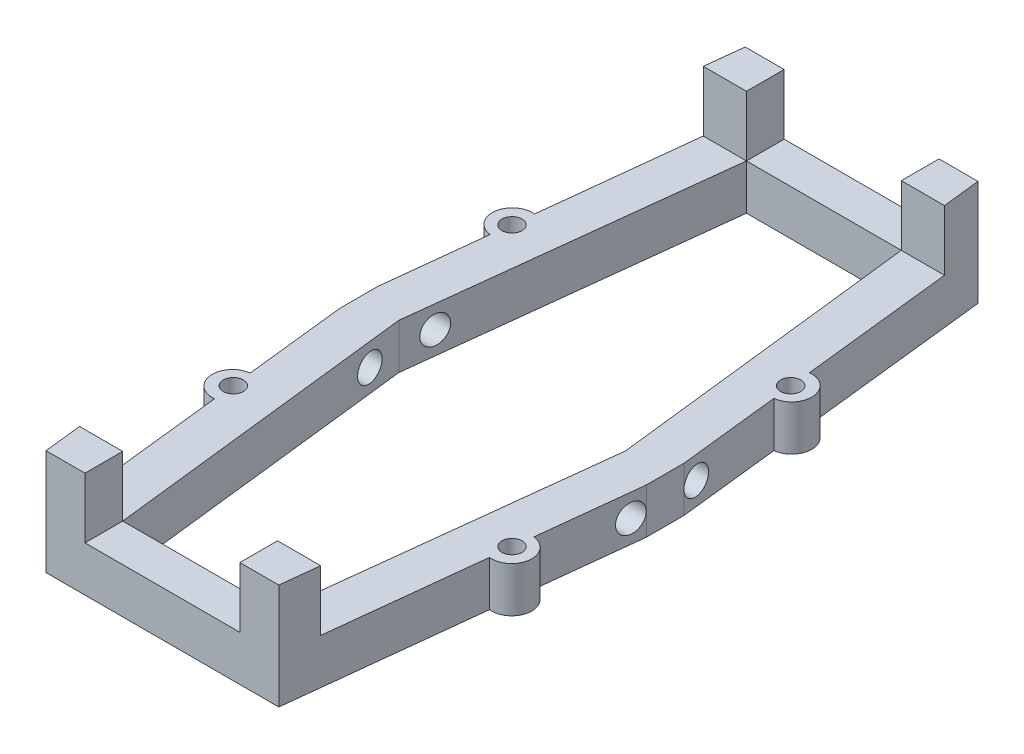
from build123d import *

# Parameters (mm, degrees)
BOSS_EXTRUDE1_DEPTH     = 4.5
BOSS_EXTRUDE5_DEPTH     = 6
SKETCH9_R               = 1
CUT_EXTRUDE2_DEPTH      = 10
CUT_EXTRUDE3_DEPTH      = 48.803846546
CUT_EXTRUDE3_DEPTH_BACK = 48.803846546
SKETCH11_R              = 1.375


with BuildPart() as part:
    # Sketch1 → Boss-Extrude1 (new body)
    with BuildSketch(Plane(origin=(0, 0, 0), x_dir=(1, 0, 0), z_dir=(0, 1, 0))):
        with BuildLine():
            Line((5.65, -1.875), (5.65, 1.875))
            Line((5.65, 1.875), (1.9, 1.875))
            Line((1.9, 1.875), (-1.875, -31))
            Line((-1.875, -31), (-17.265, -31))
            Line((-17.265, -31), (-21.04, 1.875))
            Line((-21.04, 1.875), (-24.79, 1.875))
            Line((-24.79, 1.875), (-24.79, -1.875))
            Line((-24.79, -1.875), (-23.673675208, -11.929569188))
            ThreePointArc((-23.673675208, -11.929569188), (-25.440763963, -14.138052226), (-23.232280925, -15.905140982))
            Line((-23.232280925, -15.905140982), (-21.14, -34.75))
            Line((-21.14, -34.75), (-19.14, -34.75))
            Line((-19.14, -34.75), (0, -34.75))
            Line((0, -34.75), (2, -34.75))
            Line((2, -34.75), (4.092280925, -15.905140982))
            ThreePointArc((4.092280925, -15.905140982), (6.300763963, -14.138052226), (4.533675208, -11.929569188))
            Line((4.533675208, -11.929569188), (5.65, -1.875))
        make_face()
    boss_extrude1 = extrude(amount=BOSS_EXTRUDE1_DEPTH)

    # Sketch7 → Boss-Extrude5 (add)
    with BuildSketch(Plane(origin=(0, 4.5, 0), x_dir=(1, 0, 0), z_dir=(0, 1, 0))):
        Polygon((-1.875, -31), (-1.875, -34.75), (2, -34.75), (2.41634981, -31), align=None)
        Polygon((-21.55634981, -31), (-17.265, -31), (-17.265, -34.75), (-21.14, -34.75), align=None)
    boss_extrude5 = extrude(amount=BOSS_EXTRUDE5_DEPTH)

    # Sketch9 → Cut-Extrude2 (cut)
    with BuildSketch(Plane(origin=(0, 4.5, 0), x_dir=(1, 0, 0), z_dir=(0, 1, 0))):
        with Locations((4.28, 13.85)):
            Circle(SKETCH9_R)
        with Locations((-23.42, 13.85)):
            Circle(SKETCH9_R)
        with Locations(Location((-23.42, -13.85, 0), (0, 0, 270))):
            Circle(SKETCH9_R)
        with Locations(Location((4.28, -13.85, 0), (0, 0, 270))):
            Circle(SKETCH9_R)
    cut_extrude2 = extrude(amount=-CUT_EXTRUDE2_DEPTH, mode=Mode.SUBTRACT)

    # Mirror1: Boss-Extrude1, Boss-Extrude5, Cut-Extrude2 across plane
    add(boss_extrude1.mirror(Plane.XY))
    add(boss_extrude5.mirror(Plane.XY))
    add(cut_extrude2.mirror(Plane.XY), mode=Mode.SUBTRACT)

    # Sketch11 → Cut-Extrude3 (cut, two sides: drawn at the far end of the back side and taken through both)
    with BuildSketch(Plane(origin=(5.65, 0, 0), x_dir=(0, 0, -1), z_dir=(1, 0, 0)).offset(-CUT_EXTRUDE3_DEPTH_BACK)):
        with Locations((-3.25, 2.25)):
            Circle(SKETCH11_R)
        with Locations(Location((3.25, 2.25, 0), (0, 0, 180))):
            Circle(SKETCH11_R)
    extrude(amount=CUT_EXTRUDE3_DEPTH + CUT_EXTRUDE3_DEPTH_BACK, mode=Mode.SUBTRACT)


solid = part.part
